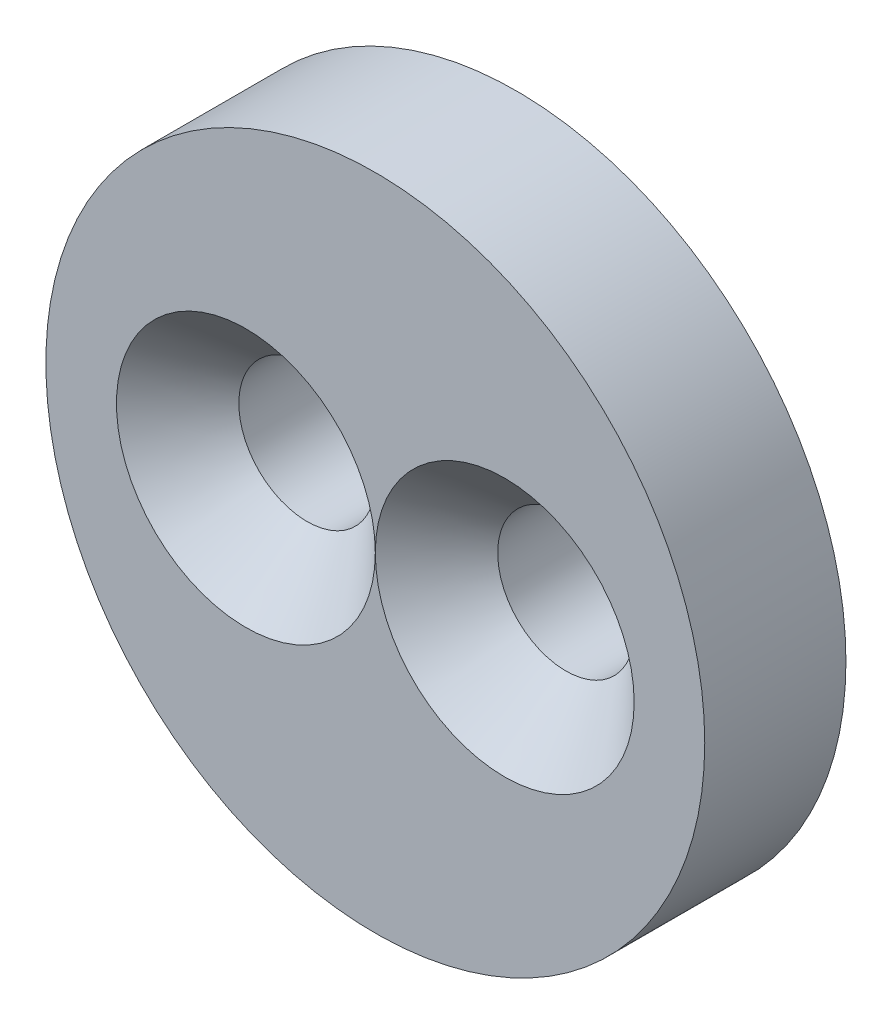
from build123d import *

# Parameters (mm, degrees)
SKETCH1_R                                            = 7
BOSS_EXTRUDE1_DEPTH                                  = 3
CSK_FOR_M2_5_COUNTERSUNK_FLAT_HEAD_SCREW_D           = 2.9
CSK_FOR_M2_5_COUNTERSUNK_FLAT_HEAD_SCREW_CSINK_D     = 5.5
CSK_FOR_M2_5_COUNTERSUNK_FLAT_HEAD_SCREW_CSINK_ANGLE = 90


with BuildPart() as part:
    # Sketch1 → Boss-Extrude1 (new body)
    with BuildSketch(Plane.XY.offset(26.85)):
        Circle(SKETCH1_R)
    extrude(amount=BOSS_EXTRUDE1_DEPTH)

    # CSK for M2.5 Countersunk Flat Head Screw1 (through all)
    with Locations(Plane.XY.offset(29.85)):
        with Locations((-2.75, 0), (2.75, 0)):
            CounterSinkHole(CSK_FOR_M2_5_COUNTERSUNK_FLAT_HEAD_SCREW_D / 2, CSK_FOR_M2_5_COUNTERSUNK_FLAT_HEAD_SCREW_CSINK_D / 2, counter_sink_angle=CSK_FOR_M2_5_COUNTERSUNK_FLAT_HEAD_SCREW_CSINK_ANGLE)


solid = part.part
